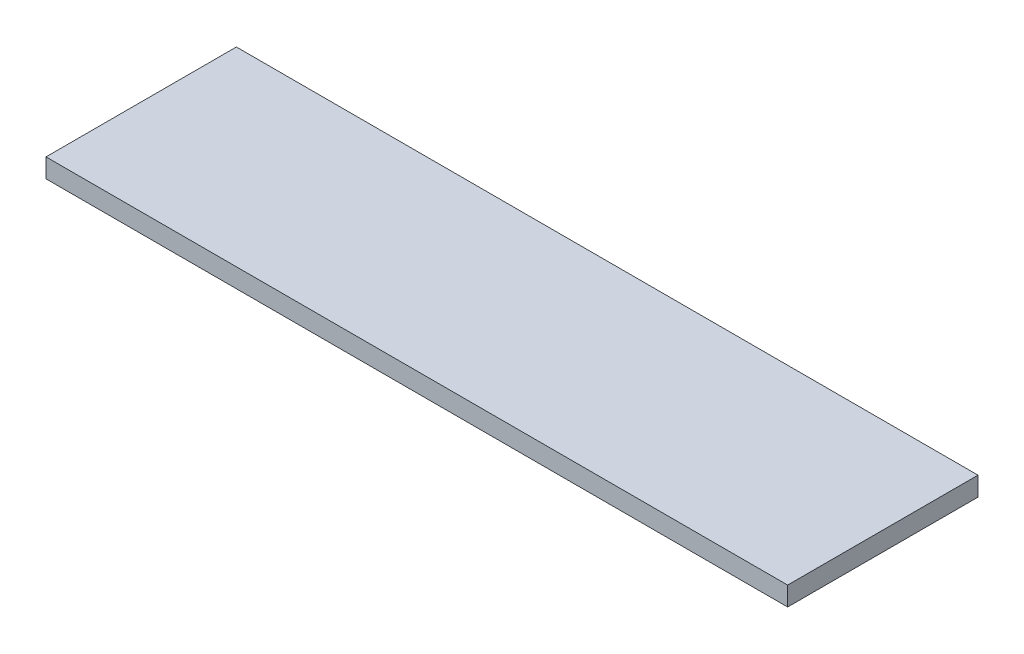
from build123d import *

# Parameters (mm, degrees)
BOSS_EXTRUDE1_DEPTH = 1.5875
CUT_EXTRUDE1_START  = -1.5875
SKETCH2_W           = 145.552464315
SKETCH2_H           = 40.152403949
SKETCH2_W_2         = 61.849
SKETCH2_H_2         = 15.875
CUT_EXTRUDE1_DEPTH  = 1.5875


with BuildPart() as part:
    # Sketch1 → Boss-Extrude1 (new body)
    with BuildSketch(Plane(origin=(0, 0, 0), x_dir=(1, 0, 0), z_dir=(0, 1, 0))):
        with BuildLine():
            Line((-47.625, 7.9375), (47.625, 7.9375))
            ThreePointArc((47.625, 7.9375), (55.5625, 0), (47.625, -7.9375))
            Line((47.625, -7.9375), (-47.625, -7.9375))
            ThreePointArc((-47.625, -7.9375), (-55.5625, 0), (-47.625, 7.9375))
        make_face()
    extrude(amount=BOSS_EXTRUDE1_DEPTH)

    # Sketch2 → Cut-Extrude1 (cut)
    with BuildSketch(Plane(origin=(0, 1.5875, 0), x_dir=(1, 0, 0), z_dir=(0, 1, 0)).offset(CUT_EXTRUDE1_START)):
        with Locations((1.351282825, 0.836508415)):
            Rectangle(SKETCH2_W, SKETCH2_H)
        Rectangle(SKETCH2_W_2, SKETCH2_H_2, mode=Mode.SUBTRACT)
    extrude(amount=CUT_EXTRUDE1_DEPTH, mode=Mode.SUBTRACT)


solid = part.part
